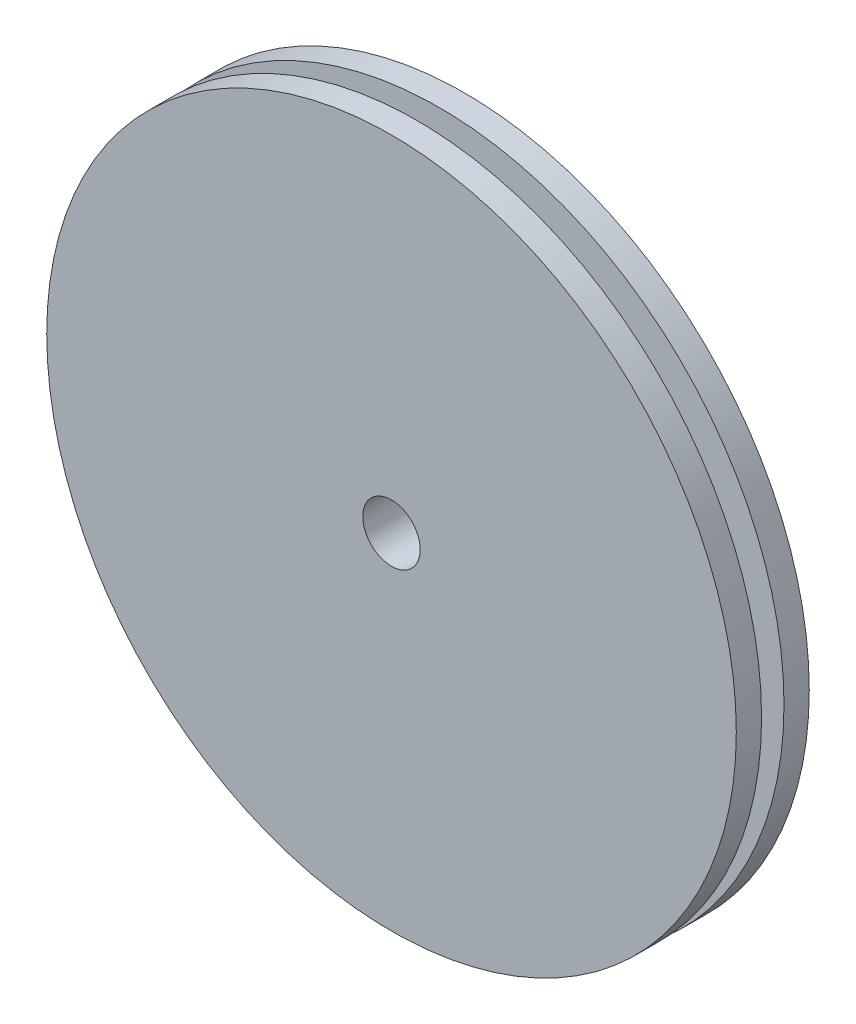
from build123d import *

# Parameters (mm, degrees)
SKETCH1_R           = 60
BOSS_EXTRUDE2_DEPTH = 4.4
SKETCH2_R           = 20
CUT_EXTRUDE1_DEPTH  = 20.9
SKETCH3_R           = 48.468089367
BOSS_EXTRUDE3_DEPTH = 3.9
SKETCH4_R           = 60
BOSS_EXTRUDE4_DEPTH = 4.4
SKETCH5_R           = 20
SKETCH5_R_2         = 3
BOSS_EXTRUDE5_DEPTH = 4
SKETCH7_R           = 5
CUT_EXTRUDE4_DEPTH  = 16


with BuildPart() as part:
    # Sketch1 → Boss-Extrude2 (new body)
    with BuildSketch(Plane.XY):
        Circle(SKETCH1_R)
    extrude(amount=BOSS_EXTRUDE2_DEPTH)

    # Sketch2 → Cut-Extrude1 (cut)
    with BuildSketch(Plane.XY.offset(4.4)):
        Circle(SKETCH2_R)
    extrude(amount=-CUT_EXTRUDE1_DEPTH, mode=Mode.SUBTRACT)

    # Sketch3 → Boss-Extrude3 (add)
    with BuildSketch(Plane.XY.offset(4.4)):
        Circle(SKETCH3_R)
    extrude(amount=BOSS_EXTRUDE3_DEPTH)

    # Sketch4 → Boss-Extrude4 (add)
    with BuildSketch(Plane.XY.offset(8.3)):
        Circle(SKETCH4_R)
    extrude(amount=BOSS_EXTRUDE4_DEPTH)

    # Sketch5 → Boss-Extrude5 (add)
    with BuildSketch(Plane(origin=(0, 0, 4.4), x_dir=(-1, 0, 0), z_dir=(0, 0, -1))):
        with Locations(Location((0, 0, 0), (0, 0, 180))):
            Circle(SKETCH5_R)
        Circle(SKETCH5_R_2, mode=Mode.SUBTRACT)
    extrude(amount=BOSS_EXTRUDE5_DEPTH)

    # Sketch7 → Cut-Extrude4 (cut)
    with BuildSketch(Plane(origin=(0, 0, 4.4), x_dir=(-1, 0, 0), z_dir=(0, 0, -1))):
        Circle(SKETCH7_R)
    extrude(amount=-CUT_EXTRUDE4_DEPTH, mode=Mode.SUBTRACT)


solid = part.part
